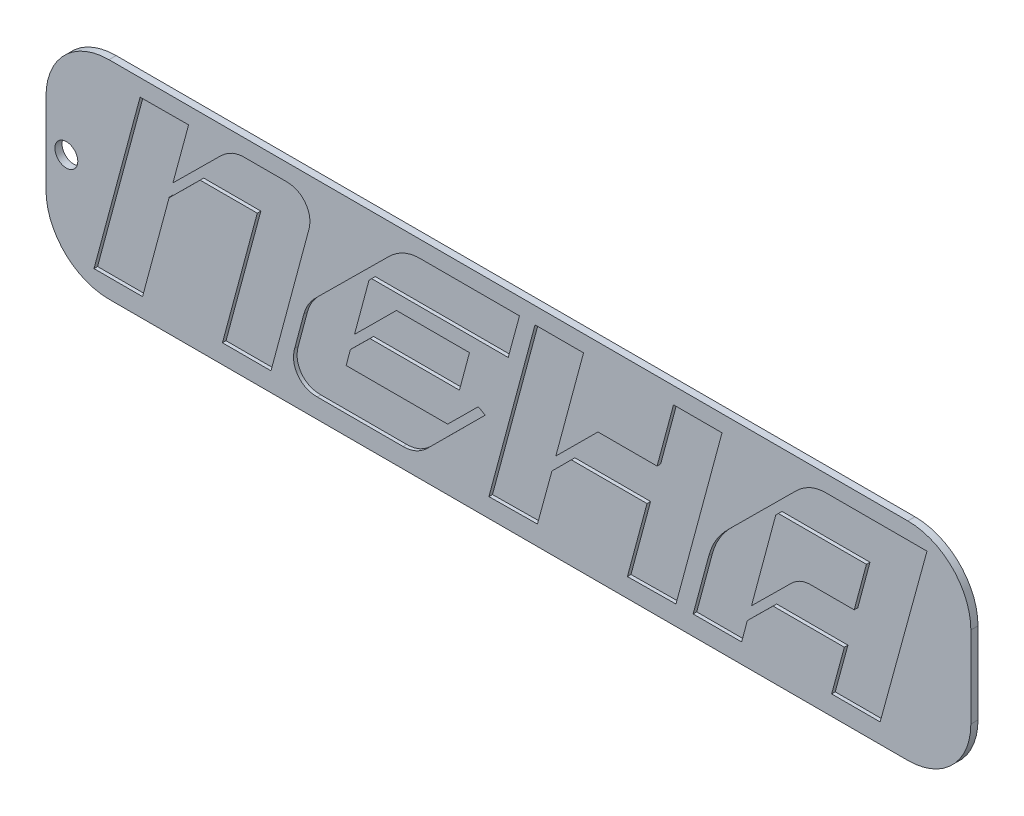
from build123d import *

# Parameters (mm, degrees)
SKETCH1_R           = 5.08
BOSS_EXTRUDE1_DEPTH = 3.175
CUT_EXTRUDE1_DEPTH  = 1.5875


with BuildPart() as part:
    # Sketch1 → Boss-Extrude1 (new body)
    with BuildSketch(Plane.XY):
        with BuildLine():
            Line((1.654255886, 83.456903623), (355.928440518, 83.456903623))
            ThreePointArc((355.928440518, 83.456903623), (375.685003985, 75.273467089), (383.868440518, 55.516903623))
            Line((383.868440518, 55.516903623), (383.868440518, 19.399703332))
            ThreePointArc((383.868440518, 19.399703332), (375.685003985, -0.356860135), (355.928440518, -8.540296668))
            Line((355.928440518, -8.540296668), (1.654255886, -8.540296668))
            ThreePointArc((1.654255886, -8.540296668), (-18.10230758, -0.356860135), (-26.285744114, 19.399703332))
            Line((-26.285744114, 19.399703332), (-26.285744114, 55.516903623))
            ThreePointArc((-26.285744114, 55.516903623), (-18.10230758, 75.273467089), (1.654255886, 83.456903623))
        make_face()
        with Locations((-17.266410752, 37.458303477)):
            Circle(SKETCH1_R, mode=Mode.SUBTRACT)
    extrude(amount=BOSS_EXTRUDE1_DEPTH)

    # Sketch2 → Cut-Extrude1 (cut)
    # profile 1 of 4: a face of its own
    with BuildSketch(Plane.XY.offset(3.175)):
        with BuildLine():
            add(Edge.make_bspline(
                [(80.116160991, 75.979814241), (80.572945846, 75.96838805), (81.464390071, 75.946089122), (82.761585994, 75.753265531), (83.980876738, 75.440347312), (85.118214528, 75.001140575), (86.167411339, 74.432836909), (87.120305277, 73.724053119), (88.006862222, 72.910504162), (88.781572714, 71.965880548), (89.463729353, 70.949833691), (89.998399018, 69.858693237), (90.395196355, 68.718158749), (90.649199151, 67.529264566), (90.751859695, 66.288698388), (90.742663347, 64.996679474), (90.564024557, 63.652201513), (90.342563176, 62.756325839), (90.228978328, 62.296842105)],
                knots=[0, 0, 0, 0, 1.092991326, 2.13304096, 3.131445324, 4.100957639, 5.0444535, 5.97821715, 6.937276196, 7.91745169, 8.895536054, 9.86089696, 10.817407172, 11.77982689, 12.762650102, 13.791815242, 14.867448903, 16, 16, 16, 16], degree=3))
            Line((90.228978328, 62.296842105), (73.494860681, -0.110092879))
            Line((73.494860681, -0.110092879), (51.963839009, -0.110092879))
            Line((51.963839009, -0.110092879), (67.408297214, 57.405572755))
            Line((67.408297214, 57.405572755), (42.07120743, 57.405572755))
            Line((42.07120743, 57.405572755), (28.482600619, 43.911331269))
            Line((28.482600619, 43.911331269), (28.37250774, 44.021424149))
            Line((28.37250774, 44.021424149), (16.529659443, -0.110092879))
            Line((16.529659443, -0.110092879), (-5.001362229, -0.110092879))
            Line((-5.001362229, -0.110092879), (15.444458204, 75.979814241))
            Line((15.444458204, 75.979814241), (36.959752322, 76.089907121))
            Line((36.959752322, 76.089907121), (30.008173375, 50.328173375))
            Line((30.008173375, 50.328173375), (51.098823529, 71.198637771))
            add(Edge.make_bspline(
                [(51.098823529, 71.198637771), (51.496763688, 71.577188987), (52.27625468, 72.318700635), (53.521895338, 73.303761259), (54.816419285, 74.114204336), (56.128007139, 74.809775832), (57.488939848, 75.322665393), (58.877070061, 75.707773792), (60.302751754, 75.930755526), (61.263328154, 75.963398777), (61.746377709, 75.979814241)],
                knots=[0, 0, 0, 0, 1.099200487, 2.15312996, 3.172151549, 4.153175518, 5.119892887, 6.077164679, 7.033054793, 8, 8, 8, 8], degree=3))
            Line((61.746377709, 75.979814241), (80.116160991, 75.979814241))
        make_face()
    # profile 2 of 4: a face of its own
    with BuildSketch(Plane.XY.offset(3.175)):
        with BuildLine():
            Line((118.145386997, 57.61003096), (116.950092879, 56.414736842))
            Line((116.950092879, 56.414736842), (110.533250774, 32.39876161))
            Line((110.533250774, 32.39876161), (129.123219814, 50.878637771))
            Line((129.123219814, 50.878637771), (161.521981424, 50.878637771))
            Line((161.521981424, 50.878637771), (157.071083591, 34.238885449))
            Line((157.071083591, 34.238885449), (117.390464396, 34.238885449))
            Line((117.390464396, 34.238885449), (108.693126935, 25.651640867))
            Line((108.693126935, 25.651640867), (106.837275542, 18.58996904))
            Line((106.837275542, 18.58996904), (151.849535604, 18.58996904))
            Line((151.849535604, 18.58996904), (165.438142415, 32.068482972))
            Line((165.438142415, 32.068482972), (168.473560372, 30.322724458))
            Line((168.473560372, 30.322724458), (142.821919505, 4.781176471))
            add(Edge.make_bspline(
                [(142.821919505, 4.781176471), (142.42558897, 4.40563779), (141.648400195, 3.669221032), (140.378629909, 2.72983858), (139.086443259, 1.922007685), (137.759547175, 1.249330178), (136.38410853, 0.749693532), (134.97817596, 0.386207664), (133.534361605, 0.157196007), (132.557907008, 0.125909425), (132.064272446, 0.110092879)],
                knots=[0, 0, 0, 0, 1.087710149, 2.132957327, 3.142311131, 4.123953504, 5.092881289, 6.053713067, 7.016078678, 8, 8, 8, 8], degree=3))
            Line((132.064272446, 0.110092879), (94.019318885, 0.110092879))
            add(Edge.make_bspline(
                [(94.019318885, 0.110092879), (93.562533058, 0.121495697), (92.671086936, 0.143749009), (91.373904534, 0.336897705), (90.159302422, 0.647440779), (89.030743975, 1.086514673), (88.001085474, 1.669343073), (87.027661194, 2.337531495), (86.162052775, 3.167267257), (85.395324382, 4.11011912), (84.737343068, 5.138224272), (84.219465728, 6.234858978), (83.812687134, 7.369301457), (83.586471856, 8.568042434), (83.471463009, 9.811604079), (83.509196493, 11.108834081), (83.679845331, 12.453440135), (83.902432286, 13.3493112), (84.016594427, 13.80879257)],
                knots=[0, 0, 0, 0, 1.094945795, 2.136855229, 3.137044923, 4.096584279, 5.030749513, 5.969051044, 6.920650617, 7.894578144, 8.878114772, 9.839711021, 10.797931648, 11.759527897, 12.756631189, 13.787866602, 14.865423694, 16, 16, 16, 16], degree=3))
            Line((84.016594427, 13.80879257), (88.042848297, 28.922972136))
            add(Edge.make_bspline(
                [(88.042848297, 28.922972136), (88.304583021, 29.762249011), (88.829432829, 31.445229009), (90.10811721, 33.789754209), (91.637210285, 36.050838621), (92.922716932, 37.371021477), (93.578947368, 38.04495356)],
                knots=[0, 0, 0, 0, 0.975136166, 1.955415087, 2.956272335, 4, 4, 4, 4], degree=3))
            Line((93.578947368, 38.04495356), (125.647430341, 69.798885449))
            add(Edge.make_bspline(
                [(125.647430341, 69.798885449), (126.173613681, 70.301463912), (127.199856843, 71.281669234), (128.852623455, 72.559024637), (130.536996878, 73.662817435), (132.286478981, 74.531301715), (134.063374504, 75.247349918), (135.898052148, 75.724007994), (137.772865678, 76.040497331), (139.040772571, 76.073408073), (139.676408669, 76.089907121)],
                knots=[0, 0, 0, 0, 1.104987577, 2.155115633, 3.169368792, 4.159784375, 5.118388166, 6.074904324, 7.034897349, 8, 8, 8, 8], degree=3))
            Line((139.676408669, 76.089907121), (183.697832817, 76.089907121))
            Line((183.697832817, 76.089907121), (178.696470588, 57.61003096))
            Line((178.696470588, 57.61003096), (118.145386997, 57.61003096))
        make_face()
    # profile 3 of 4: a face of its own
    with BuildSketch(Plane.XY.offset(3.175)):
        Polygon((252.002600619, 76.089907121), (273.517894737, 76.089907121), (253.087801858, 0.110092879), (231.556780186, -0.110092879), (240.254117647, 32.288668731), (206.675789474, 32.288668731), (198.088544892, 23.701424149), (191.671702786, 0.110092879), (170.140681115, -0.110092879), (190.586501548, 76.089907121), (212.101795666, 76.089907121), (199.818575851, 30.322724458), (218.518637771, 48.912693498), (244.720743034, 48.912693498), align=None)
    # profile 4 of 4: a face of its own
    with BuildSketch(Plane.XY.offset(3.175)):
        with BuildLine():
            Line((319.631083591, 76.089907121), (364.423157895, 76.089907121))
            Line((364.423157895, 76.089907121), (343.647058824, 0.110092879))
            Line((343.647058824, 0.110092879), (322.131764706, 0.110092879))
            Line((322.131764706, 0.110092879), (327.777956656, 20.870464396))
            Line((327.777956656, 20.870464396), (296.149845201, 20.870464396))
            Line((296.149845201, 20.870464396), (284.731640867, 9.562352941))
            Line((284.731640867, 9.562352941), (282.230959752, 0.110092879))
            Line((282.230959752, 0.110092879), (260.715665635, 0.110092879))
            Line((260.715665635, 0.110092879), (267.667244582, 25.981919505))
            add(Edge.make_bspline(
                [(267.667244582, 25.981919505), (267.86289602, 26.645371072), (268.253866848, 27.971148241), (268.999777356, 29.910929371), (269.877436893, 31.800461991), (270.912218434, 33.634395292), (272.071806246, 35.421190898), (273.36391227, 37.159516171), (274.805405218, 38.829815678), (275.840128897, 39.895431078), (276.364582043, 40.435541796)],
                knots=[0, 0, 0, 0, 0.972188851, 1.942727767, 2.918792729, 3.89888478, 4.900660299, 5.911935627, 6.941657613, 8, 8, 8, 8], degree=3))
            Line((276.364582043, 40.435541796), (306.372755418, 70.223529412))
            add(Edge.make_bspline(
                [(306.372755418, 70.223529412), (306.868599043, 70.68811599), (307.842110474, 71.600259095), (309.403215924, 72.799594193), (311.01411719, 73.806711452), (312.651676458, 74.649150324), (314.336608539, 75.305189439), (316.067863306, 75.757242357), (317.839849704, 76.032176586), (319.032476302, 76.07061432), (319.631083591, 76.089907121)],
                knots=[0, 0, 0, 0, 1.09520327, 2.15026038, 3.168190723, 4.15492977, 5.115689715, 6.0773418, 7.034972711, 8, 8, 8, 8], degree=3))
        make_face()
        with BuildLine():
            Line((332.134489164, 37.400123839), (337.560495356, 57.61003096))
            Line((337.560495356, 57.61003096), (298.540433437, 57.61003096))
            Line((298.540433437, 57.61003096), (297.345139319, 56.414736842))
            Line((297.345139319, 56.414736842), (286.58749226, 16.199380805))
            Line((286.58749226, 16.199380805), (304.076532508, 33.483962848))
            add(Edge.make_bspline(
                [(304.076532508, 33.483962848), (304.401991303, 33.793484328), (305.041456362, 34.401635574), (306.065728499, 35.204466573), (307.125276195, 35.892296283), (308.222062479, 36.433077589), (309.339430868, 36.874999281), (310.492804301, 37.163848907), (311.676386408, 37.365984392), (312.479426341, 37.388687169), (312.883962848, 37.400123839)],
                knots=[0, 0, 0, 0, 1.088018936, 2.137751703, 3.149265309, 4.143636785, 5.096896491, 6.055307392, 7.020348651, 8, 8, 8, 8], degree=3))
            Line((312.883962848, 37.400123839), (332.134489164, 37.400123839))
        make_face(mode=Mode.SUBTRACT)
    extrude(amount=-CUT_EXTRUDE1_DEPTH, mode=Mode.SUBTRACT)


solid = part.part
